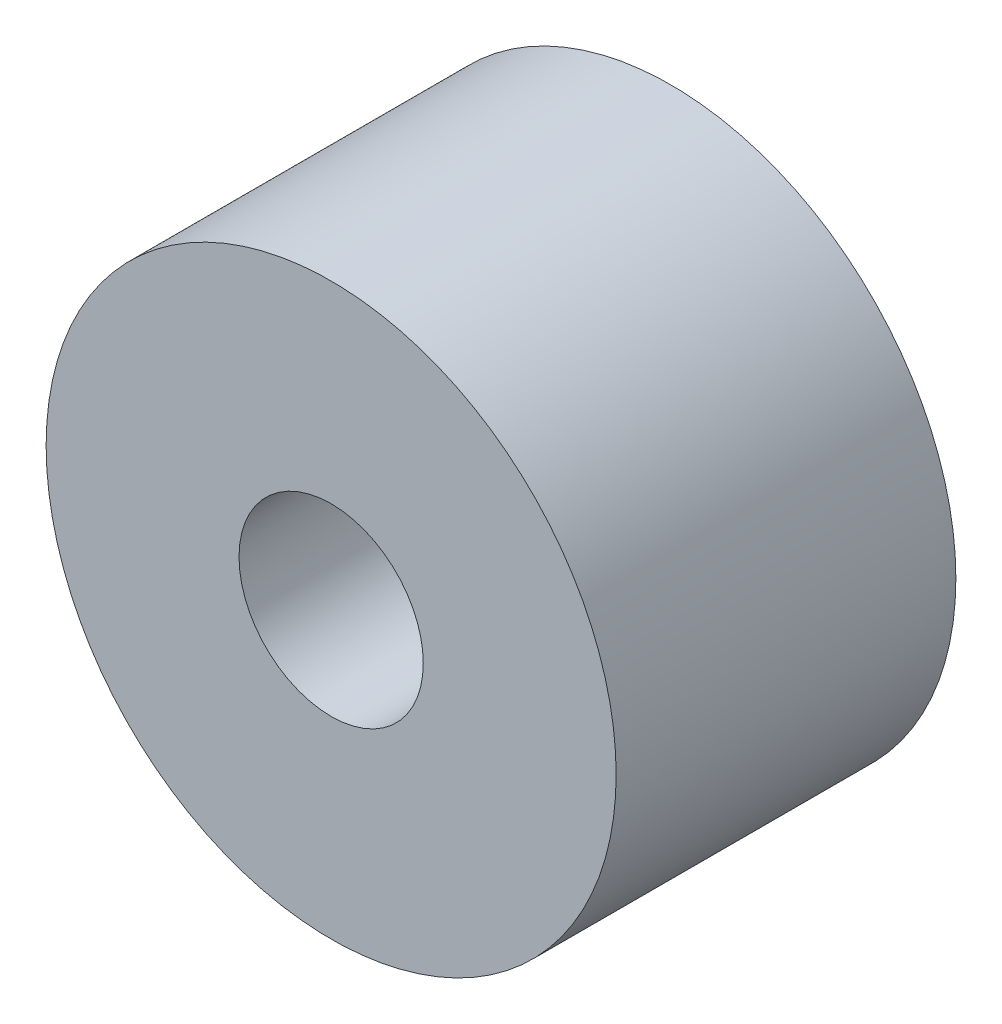
from build123d import *

# Parameters (mm, degrees)
ESQUISSE1_R             = 4.95
BOSS_EXTRU_1_DEPTH      = 5.9
ESQUISSE2_R             = 1.6
ENL_V_MAT_EXTRU_1_DEPTH = 5.9
ENL_V_MAT_EXTRU_2_DEPTH = 3


with BuildPart() as part:
    # Esquisse1 → Boss.-Extru.1 (new body)
    with BuildSketch(Plane.XY):
        Circle(ESQUISSE1_R)
    extrude(amount=BOSS_EXTRU_1_DEPTH)

    # Esquisse2 → Enlèv. mat.-Extru.1 (cut)
    with BuildSketch(Plane(origin=(0, 0, 0), x_dir=(-1, 0, 0), z_dir=(0, 0, -1))):
        Circle(ESQUISSE2_R)
    extrude(amount=-ENL_V_MAT_EXTRU_1_DEPTH, mode=Mode.SUBTRACT)

    # Esquisse3 → Enlèv. mat.-Extru.2 (cut)
    with BuildSketch(Plane(origin=(0, 0, 0), x_dir=(-1, 0, 0), z_dir=(0, 0, -1))):
        Polygon((-0.949092992, -3.211316837), (2.306535464, -2.42759706), (3.255628456, 0.783719777), (0.949092992, 3.211316837), (-2.306535464, 2.42759706), (-3.255628456, -0.783719777), align=None)
    extrude(amount=-ENL_V_MAT_EXTRU_2_DEPTH, mode=Mode.SUBTRACT)


solid = part.part
